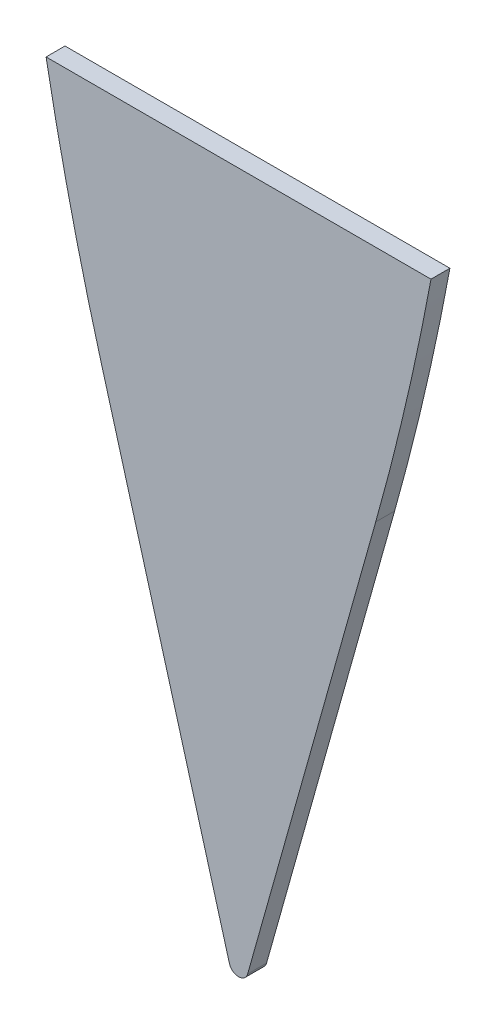
from build123d import *

# Parameters (mm, degrees)
BOSS_EXTRUDE1_DEPTH = 10
SKETCH4_W           = 250.383382942
SKETCH4_H           = 630
CUT_EXTRUDE2_DEPTH  = 1008.855624389


with BuildPart() as part:
    # Sketch2 → Boss-Extrude1 (new body)
    with BuildSketch(Plane.XY):
        with BuildLine():
            Line((-75, 0), (75, 0))
            ThreePointArc((75, 0), (125.183748831, -378.01295639), (72.466338168, -755.680903745))
            Line((72.466338168, -755.680903745), (4.813443083, -996.353057902))
            ThreePointArc((4.813443083, -996.353057902), (3.01949586, -998.985303596), (0, -1000))
            ThreePointArc((0, -1000), (-3.01949586, -998.985303596), (-4.813443083, -996.353057902))
            Line((-4.813443083, -996.353057902), (-72.466338168, -755.680903745))
            ThreePointArc((-72.466338168, -755.680903745), (-125.183748831, -378.01295639), (-75, 0))
        make_face()
    extrude(amount=BOSS_EXTRUDE1_DEPTH)

    # Sketch4 → Cut-Extrude2 (cut, through all)
    with BuildSketch(Plane(origin=(0, 0, 0), x_dir=(-1, 0, 0), z_dir=(0, 0, -1))):
        with Locations((0, -315)):
            Rectangle(SKETCH4_W, SKETCH4_H)
    extrude(amount=-CUT_EXTRUDE2_DEPTH, mode=Mode.SUBTRACT)


solid = part.part
